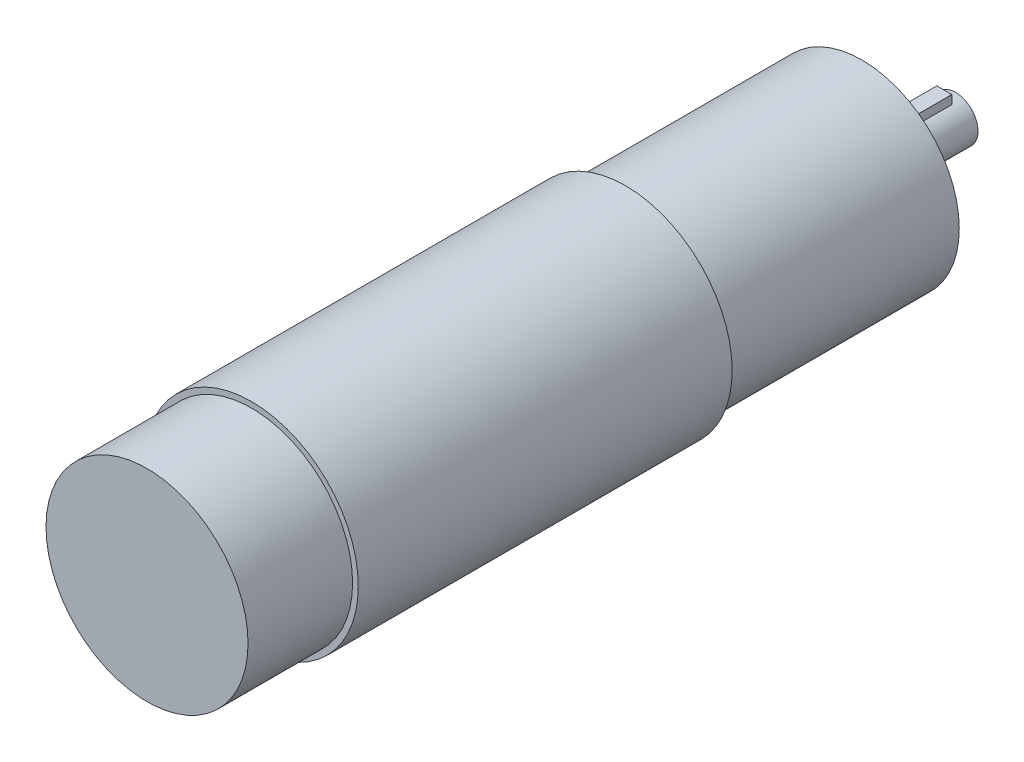
from build123d import *

# Parameters (mm, degrees)
SKETCH2_W           = 16
SKETCH2_H           = 3.081282867
BOSS_EXTRUDE1_DEPTH = 2


with BuildPart() as part:
    # Sketch1 → Revolve1 (revolve)
    with BuildSketch(Plane(origin=(0, 0, 0), x_dir=(0, 0, -1), z_dir=(1, 0, 0)), mode=Mode.PRIVATE) as revolve1_sk:
        Polygon((0, 0), (207.054133767, 0), (208.008, 1.5875), (215.4365, 1.5875), (216.008, 2.159), (216.008, 6), (194.008, 6), (194.008, 16), (191.008, 16), (191.008, 26), (127.837178898, 26), (127.837178898, 28.5), (27.94, 28.5), (27.94, 26.9875), (0, 26.9875), align=None)
    revolve(revolve1_sk.sketch.rotate(Axis((0, 0, 10.8794825), (0, 0, -1)), 90), axis=Axis((0, 0, 10.8794825), (0, 0, -1)))

    # Sketch2 → Boss-Extrude1 (add, symmetric)
    with BuildSketch(Plane(origin=(0, 0, 0), x_dir=(0, 0, -1), z_dir=(1, 0, 0))):
        with Locations((205.008, 6.459358567)):
            Rectangle(SKETCH2_W, SKETCH2_H)
    extrude(amount=BOSS_EXTRUDE1_DEPTH, both=True)


solid = part.part
